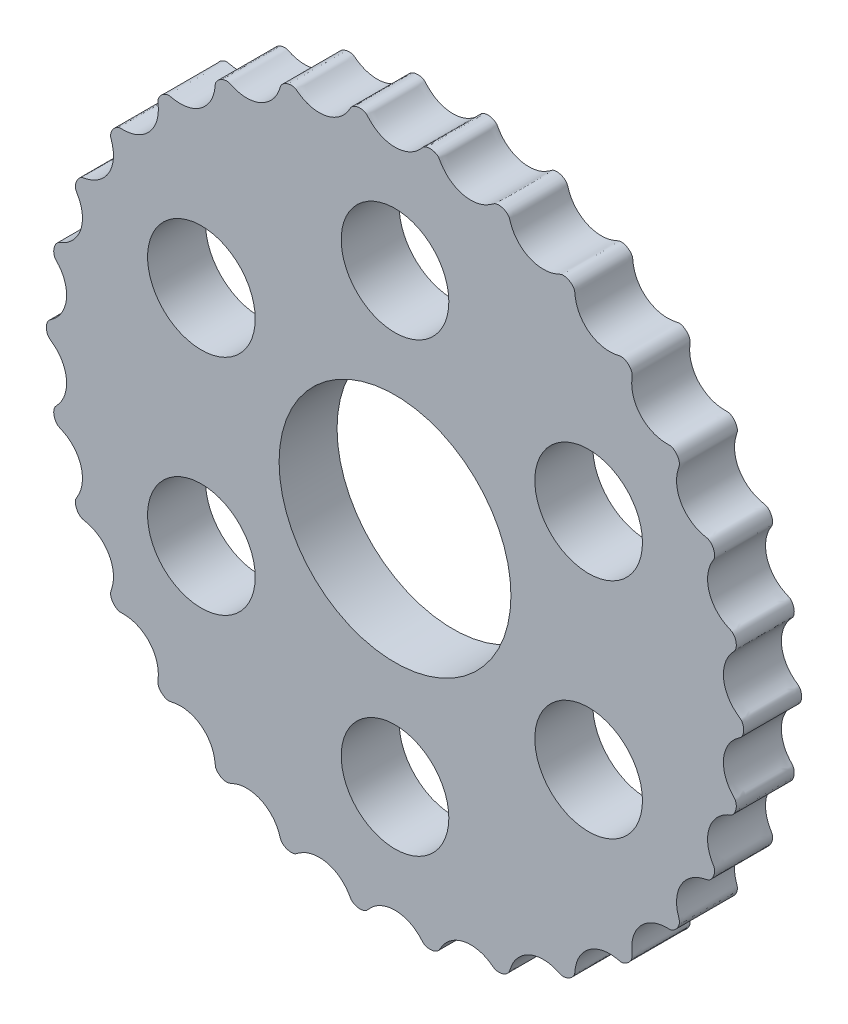
from build123d import *

# Parameters (mm, degrees)
BOSS_EXTRUDE2_DEPTH = 7
SKETCH5_R           = 14
SKETCH5_R_2         = 6.5
CUT_EXTRUDE2_DEPTH  = 7


with BuildPart() as part:
    # Sketch4 → Boss-Extrude2 (new body)
    with BuildSketch(Plane.XY):
        with BuildLine():
            add(Edge.make_bspline(
                [(0, 39.9), (-0.867862173, 39.9), (-2.053769009, 40.297142286), (-2.993701321, 41.15010635), (-3.290716037, 41.483410093), (-3.394824363, 41.596730239), (-3.451153808, 41.648851793), (-3.508551514, 41.691620086), (-3.587956385, 41.738653868), (-3.698246562, 41.788603484), (-3.840725679, 41.834402719), (-4.01118888, 41.867939782), (-4.201523411, 41.882323153), (-4.40107338, 41.873405416), (-4.598116651, 41.840636229), (-4.781304367, 41.78700752), (-4.94106606, 41.718752256), (-5.070904682, 41.644330318), (-5.168403341, 41.572548193), (-5.23629071, 41.510028931), (-5.283550467, 41.456265489), (-5.327802047, 41.393558839), (-5.406082214, 41.261074736), (-5.627304443, 40.873297035), (-6.3693724, 39.843566652), (-8.235255534, 38.74379281), (-10.387118038, 38.989581665), (-11.483883972, 39.628428942), (-11.843675344, 39.892743014), (-11.969095474, 39.981903479), (-12.035021107, 40.021196066), (-12.100060784, 40.051087697), (-12.187504024, 40.080603604), (-12.305776156, 40.106502749), (-12.454658081, 40.121702633), (-12.628368763, 40.119052453), (-12.817530355, 40.093536021), (-13.010873806, 40.043345394), (-13.1967931, 39.970312141), (-13.364824622, 39.879771162), (-13.50691375, 39.77980239), (-13.618420685, 39.679988309), (-13.698891055, 39.589522313), (-13.752279067, 39.514244292), (-13.787345076, 39.451839), (-13.817568032, 39.381291859), (-13.866629173, 39.235440902), (-14.002343934, 38.810124757), (-14.514147108, 37.648628945), (-16.110568287, 36.184932781), (-18.266525561, 35.977959715), (-19.472144723, 36.374823111), (-19.879029007, 36.558552949), (-20.020246261, 36.619689471), (-20.092902659, 36.644418038), (-20.162739421, 36.660123399), (-20.254406118, 36.670823157), (-20.375476281, 36.671556594), (-20.524265484, 36.655482765), (-20.693633391, 36.616776963), (-20.873353144, 36.552480209), (-21.052032881, 36.46318634), (-21.218708339, 36.353102), (-21.364236105, 36.229590507), (-21.482450087, 36.10227854), (-21.570763539, 35.981456079), (-21.630649294, 35.876231819), (-21.66723675, 35.791504827), (-21.688550736, 35.72317075), (-21.703453992, 35.647884895), (-21.721120537, 35.495020633), (-21.765446262, 35.050781121), (-22.024570861, 33.808253812), (-23.281787595, 32.044648934), (-25.347602516, 31.393897517), (-26.609377531, 31.531487852), (-27.045578774, 31.626549793), (-27.196412701, 31.657030459), (-27.272625968, 31.666092766), (-27.344202322, 31.66695979), (-27.436086449, 31.658334151), (-27.554668468, 31.63391253), (-27.696858442, 31.587225288), (-27.854479363, 31.51415622), (-28.016910616, 31.413909426), (-28.17312248, 31.289420344), (-28.313249318, 31.147072883), (-28.429939632, 30.996019107), (-28.51907839, 30.846898913), (-28.580371612, 30.710365831), (-28.617050925, 30.594986054), (-28.635236785, 30.504503244), (-28.641856958, 30.433231277), (-28.640811645, 30.356489439), (-28.626260334, 30.203298111), (-28.577310262, 29.759547319), (-28.572378806, 28.490299736), (-29.435493607, 26.503830076), (-31.320855821, 25.437825908), (-32.583663593, 25.310034872), (-33.030099211, 25.312357592), (-33.1839743, 25.310795606), (-33.260405999, 25.303822489), (-33.330596599, 25.289777884), (-33.418681028, 25.262241256), (-33.529592958, 25.213696494), (-33.658965182, 25.138464354), (-33.797955686, 25.0342296), (-33.935992938, 24.902397018), (-34.062909452, 24.748150521), (-34.17038123, 24.579777083), (-34.253117673, 24.407763884), (-34.30930012, 24.243364778), (-34.34086238, 24.097075442), (-34.352766326, 23.976589981), (-34.351724814, 23.884307609), (-34.343403373, 23.813210072), (-34.326391089, 23.738372389), (-34.280353354, 23.591541797), (-34.140155476, 23.167682585), (-33.871504163, 21.927178673), (-34.302697492, 19.804685831), (-35.925234266, 18.369949976), (-37.133886991, 17.982442368), (-37.571043574, 17.891866094), (-37.721235663, 17.858357953), (-37.794548417, 17.83564683), (-37.860277764, 17.807304514), (-37.940725669, 17.762080132), (-38.039105993, 17.691509807), (-38.150029804, 17.591046281), (-38.26429222, 17.460175106), (-38.37190826, 17.302530324), (-38.463966784, 17.125260998), (-38.534115325, 16.938233404), (-38.579257238, 16.752772137), (-38.600045748, 16.580286821), (-38.600492513, 16.430633118), (-38.587083879, 16.310305933), (-38.566890979, 16.220251558), (-38.543954221, 16.152442484), (-38.511778493, 16.082764651), (-38.436178924, 15.948733596), (-38.21096583, 15.563261882), (-37.690235222, 14.405744429), (-37.670740143, 12.23996324), (-38.959525869, 10.499276186), (-40.061170431, 9.868887576), (-40.469960363, 9.68944059), (-40.609889204, 9.62541929), (-40.676885583, 9.587972137), (-40.735287905, 9.546578387), (-40.804571348, 9.485611057), (-40.88613014, 9.396134355), (-40.973735666, 9.274802793), (-41.058313935, 9.123046913), (-41.130780329, 8.946459582), (-41.183982978, 8.753927812), (-41.213699302, 8.556399698), (-41.219300672, 8.365606209), (-41.203785057, 8.192565592), (-41.173088823, 8.046093135), (-41.134972279, 7.931178846), (-41.096477862, 7.847299492), (-41.05995772, 7.78573425), (-41.01399797, 7.724267701), (-40.912186828, 7.608880775), (-40.611759089, 7.278650812), (-39.861724818, 6.254715406), (-39.392356495, 4.140291659), (-40.291109103, 2.169726977), (-41.237583496, 1.324026514), (-41.600150739, 1.063532091), (-41.723700707, 0.971799219), (-41.781453664, 0.921250534), (-41.829976569, 0.868623412), (-41.88505136, 0.794571708), (-41.94624731, 0.690106561), (-42.00669721, 0.553203928), (-42.057873473, 0.38717871), (-42.092051529, 0.19938699), (-42.104064912, 0), (-42.092051529, -0.19938699), (-42.057873473, -0.38717871), (-42.00669721, -0.553203928), (-41.94624731, -0.690106561), (-41.88505136, -0.794571708), (-41.829976569, -0.868623412), (-41.781453664, -0.921250534), (-41.723700707, -0.971799219), (-41.600150739, -1.063532091), (-41.237583496, -1.324026514), (-40.291109103, -2.169726977), (-39.392356495, -4.140291659), (-39.861724818, -6.254715406), (-40.611759089, -7.278650812), (-40.912186828, -7.608880775), (-41.01399797, -7.724267701), (-41.05995772, -7.78573425), (-41.096477862, -7.847299492), (-41.134972279, -7.931178846), (-41.173088823, -8.046093135), (-41.203785057, -8.192565592), (-41.219300672, -8.365606209), (-41.213699302, -8.556399698), (-41.183982978, -8.753927812), (-41.130780329, -8.946459582), (-41.058313935, -9.123046913), (-40.973735666, -9.274802793), (-40.88613014, -9.396134355), (-40.804571348, -9.485611057), (-40.735287905, -9.546578387), (-40.676885583, -9.587972137), (-40.609889204, -9.62541929), (-40.469960363, -9.68944059), (-40.061170431, -9.868887576), (-38.959525869, -10.499276186), (-37.670740143, -12.23996324), (-37.690235222, -14.405744429), (-38.21096583, -15.563261882), (-38.436178924, -15.948733596), (-38.511778493, -16.082764651), (-38.543954221, -16.152442484), (-38.566890979, -16.220251558), (-38.587083879, -16.310305933), (-38.600492513, -16.430633118), (-38.600045748, -16.580286821), (-38.579257238, -16.752772137), (-38.534115325, -16.938233404), (-38.463966784, -17.125260998), (-38.37190826, -17.302530324), (-38.26429222, -17.460175106), (-38.150029804, -17.591046281), (-38.039105993, -17.691509807), (-37.940725669, -17.762080132), (-37.860277764, -17.807304514), (-37.794548417, -17.83564683), (-37.721235663, -17.858357953), (-37.571043574, -17.891866094), (-37.133886991, -17.982442368), (-35.925234266, -18.369949976), (-34.302697492, -19.804685831), (-33.871504163, -21.927178673), (-34.140155476, -23.167682585), (-34.280353354, -23.591541797), (-34.326391089, -23.738372389), (-34.343403373, -23.813210072), (-34.351724814, -23.884307609), (-34.352766326, -23.976589981), (-34.34086238, -24.097075442), (-34.30930012, -24.243364778), (-34.253117673, -24.407763884), (-34.17038123, -24.579777083), (-34.062909452, -24.748150521), (-33.935992938, -24.902397018), (-33.797955686, -25.0342296), (-33.658965182, -25.138464354), (-33.529592958, -25.213696494), (-33.418681028, -25.262241256), (-33.330596599, -25.289777884), (-33.260405999, -25.303822489), (-33.1839743, -25.310795606), (-33.030099211, -25.312357592), (-32.583663593, -25.310034872), (-31.320855821, -25.437825908), (-29.435493607, -26.503830076), (-28.572378806, -28.490299736), (-28.577310262, -29.759547319), (-28.626260334, -30.203298111), (-28.640811645, -30.356489439), (-28.641856958, -30.433231277), (-28.635236785, -30.504503244), (-28.617050925, -30.594986054), (-28.580371612, -30.710365831), (-28.51907839, -30.846898913), (-28.429939632, -30.996019107), (-28.313249318, -31.147072883), (-28.17312248, -31.289420344), (-28.016910616, -31.413909426), (-27.854479363, -31.51415622), (-27.696858442, -31.587225288), (-27.554668468, -31.63391253), (-27.436086449, -31.658334151), (-27.344202322, -31.66695979), (-27.272625968, -31.666092766), (-27.196412701, -31.657030459), (-27.045578774, -31.626549793), (-26.609377531, -31.531487852), (-25.347602516, -31.393897517), (-23.281787595, -32.044648934), (-22.024570861, -33.808253812), (-21.765446262, -35.050781121), (-21.721120537, -35.495020633), (-21.703453992, -35.647884895), (-21.688550736, -35.72317075), (-21.66723675, -35.791504827), (-21.630649294, -35.876231819), (-21.570763539, -35.981456079), (-21.482450087, -36.10227854), (-21.364236105, -36.229590507), (-21.218708339, -36.353102), (-21.052032881, -36.46318634), (-20.873353144, -36.552480209), (-20.693633391, -36.616776963), (-20.524265484, -36.655482765), (-20.375476281, -36.671556594), (-20.254406118, -36.670823157), (-20.162739421, -36.660123399), (-20.092902659, -36.644418038), (-20.020246261, -36.619689471), (-19.879029007, -36.558552949), (-19.472144723, -36.374823111), (-18.266525561, -35.977959715), (-16.110568287, -36.184932781), (-14.514147108, -37.648628945), (-14.002343934, -38.810124757), (-13.866629173, -39.235440902), (-13.817568032, -39.381291859), (-13.787345076, -39.451839), (-13.752279067, -39.514244292), (-13.698891055, -39.589522313), (-13.618420685, -39.679988309), (-13.50691375, -39.77980239), (-13.364824622, -39.879771162), (-13.1967931, -39.970312141), (-13.010873806, -40.043345394), (-12.817530355, -40.093536021), (-12.628368763, -40.119052453), (-12.454658081, -40.121702633), (-12.305776156, -40.106502749), (-12.187504024, -40.080603604), (-12.100060784, -40.051087697), (-12.035021107, -40.021196066), (-11.969095474, -39.981903479), (-11.843675344, -39.892743014), (-11.483883972, -39.628428942), (-10.387118038, -38.989581665), (-8.235255534, -38.74379281), (-6.3693724, -39.843566652), (-5.627304443, -40.873297035), (-5.406082214, -41.261074736), (-5.327802047, -41.393558839), (-5.283550467, -41.456265489), (-5.23629071, -41.510028931), (-5.168403341, -41.572548193), (-5.070904682, -41.644330318), (-4.94106606, -41.718752256), (-4.781304367, -41.78700752), (-4.598116651, -41.840636229), (-4.40107338, -41.873405416), (-4.201523411, -41.882323153), (-4.01118888, -41.867939782), (-3.840725679, -41.834402719), (-3.698246562, -41.788603484), (-3.587956385, -41.738653868), (-3.508551514, -41.691620086), (-3.451153808, -41.648851793), (-3.394824363, -41.596730239), (-3.290716037, -41.483410093), (-2.993701321, -41.15010635), (-2.053769009, -40.297142286), (0, -39.609366068), (2.053769009, -40.297142286), (2.993701321, -41.15010635), (3.290716037, -41.483410093), (3.394824363, -41.596730239), (3.451153808, -41.648851793), (3.508551514, -41.691620086), (3.587956385, -41.738653868), (3.698246562, -41.788603484), (3.840725679, -41.834402719), (4.01118888, -41.867939782), (4.201523411, -41.882323153), (4.40107338, -41.873405416), (4.598116651, -41.840636229), (4.781304367, -41.78700752), (4.94106606, -41.718752256), (5.070904682, -41.644330318), (5.168403341, -41.572548193), (5.23629071, -41.510028931), (5.283550467, -41.456265489), (5.327802047, -41.393558839), (5.406082214, -41.261074736), (5.627304443, -40.873297035), (6.3693724, -39.843566652), (8.235255534, -38.74379281), (10.387118038, -38.989581665), (11.483883972, -39.628428942), (11.843675344, -39.892743014), (11.969095474, -39.981903479), (12.035021107, -40.021196066), (12.100060784, -40.051087697), (12.187504024, -40.080603604), (12.305776156, -40.106502749), (12.454658081, -40.121702633), (12.628368763, -40.119052453), (12.817530355, -40.093536021), (13.010873806, -40.043345394), (13.1967931, -39.970312141), (13.364824622, -39.879771162), (13.50691375, -39.77980239), (13.618420685, -39.679988309), (13.698891055, -39.589522313), (13.752279067, -39.514244292), (13.787345076, -39.451839), (13.817568032, -39.381291859), (13.866629173, -39.235440902), (14.002343934, -38.810124757), (14.514147108, -37.648628945), (16.110568287, -36.184932781), (18.266525561, -35.977959715), (19.472144723, -36.374823111), (19.879029007, -36.558552949), (20.020246261, -36.619689471), (20.092902659, -36.644418038), (20.162739421, -36.660123399), (20.254406118, -36.670823157), (20.375476281, -36.671556594), (20.524265484, -36.655482765), (20.693633391, -36.616776963), (20.873353144, -36.552480209), (21.052032881, -36.46318634), (21.218708339, -36.353102), (21.364236105, -36.229590507), (21.482450087, -36.10227854), (21.570763539, -35.981456079), (21.630649294, -35.876231819), (21.66723675, -35.791504827), (21.688550736, -35.72317075), (21.703453992, -35.647884895), (21.721120537, -35.495020633), (21.765446262, -35.050781121), (22.024570861, -33.808253812), (23.281787595, -32.044648934), (25.347602516, -31.393897517), (26.609377531, -31.531487852), (27.045578774, -31.626549793), (27.196412701, -31.657030459), (27.272625968, -31.666092766), (27.344202322, -31.66695979), (27.436086449, -31.658334151), (27.554668468, -31.63391253), (27.696858442, -31.587225288), (27.854479363, -31.51415622), (28.016910616, -31.413909426), (28.17312248, -31.289420344), (28.313249318, -31.147072883), (28.429939632, -30.996019107), (28.51907839, -30.846898913), (28.580371612, -30.710365831), (28.617050925, -30.594986054), (28.635236785, -30.504503244), (28.641856958, -30.433231277), (28.640811645, -30.356489439), (28.626260334, -30.203298111), (28.577310262, -29.759547319), (28.572378806, -28.490299736), (29.435493607, -26.503830076), (31.320855821, -25.437825908), (32.583663593, -25.310034872), (33.030099211, -25.312357592), (33.1839743, -25.310795606), (33.260405999, -25.303822489), (33.330596599, -25.289777884), (33.418681028, -25.262241256), (33.529592958, -25.213696494), (33.658965182, -25.138464354), (33.797955686, -25.0342296), (33.935992938, -24.902397018), (34.062909452, -24.748150521), (34.17038123, -24.579777083), (34.253117673, -24.407763884), (34.30930012, -24.243364778), (34.34086238, -24.097075442), (34.352766326, -23.976589981), (34.351724814, -23.884307609), (34.343403373, -23.813210072), (34.326391089, -23.738372389), (34.280353354, -23.591541797), (34.140155476, -23.167682585), (33.871504163, -21.927178673), (34.302697492, -19.804685831), (35.925234266, -18.369949976), (37.133886991, -17.982442368), (37.571043574, -17.891866094), (37.721235663, -17.858357953), (37.794548417, -17.83564683), (37.860277764, -17.807304514), (37.940725669, -17.762080132), (38.039105993, -17.691509807), (38.150029804, -17.591046281), (38.26429222, -17.460175106), (38.37190826, -17.302530324), (38.463966784, -17.125260998), (38.534115325, -16.938233404), (38.579257238, -16.752772137), (38.600045748, -16.580286821), (38.600492513, -16.430633118), (38.587083879, -16.310305933), (38.566890979, -16.220251558), (38.543954221, -16.152442484), (38.511778493, -16.082764651), (38.436178924, -15.948733596), (38.21096583, -15.563261882), (37.690235222, -14.405744429), (37.670740143, -12.23996324), (38.959525869, -10.499276186), (40.061170431, -9.868887576), (40.469960363, -9.68944059), (40.609889204, -9.62541929), (40.676885583, -9.587972137), (40.735287905, -9.546578387), (40.804571348, -9.485611057), (40.88613014, -9.396134355), (40.973735666, -9.274802793), (41.058313935, -9.123046913), (41.130780329, -8.946459582), (41.183982978, -8.753927812), (41.213699302, -8.556399698), (41.219300672, -8.365606209), (41.203785057, -8.192565592), (41.173088823, -8.046093135), (41.134972279, -7.931178846), (41.096477862, -7.847299492), (41.05995772, -7.78573425), (41.01399797, -7.724267701), (40.912186828, -7.608880775), (40.611759089, -7.278650812), (39.861724818, -6.254715406), (39.392356495, -4.140291659), (40.291109103, -2.169726977), (41.237583496, -1.324026514), (41.600150739, -1.063532091), (41.723700707, -0.971799219), (41.781453664, -0.921250534), (41.829976569, -0.868623412), (41.88505136, -0.794571708), (41.94624731, -0.690106561), (42.00669721, -0.553203928), (42.057873473, -0.38717871), (42.092051529, -0.19938699), (42.104064912, 0), (42.092051529, 0.19938699), (42.057873473, 0.38717871), (42.00669721, 0.553203928), (41.94624731, 0.690106561), (41.88505136, 0.794571708), (41.829976569, 0.868623412), (41.781453664, 0.921250534), (41.723700707, 0.971799219), (41.600150739, 1.063532091), (41.237583496, 1.324026514), (40.291109103, 2.169726977), (39.392356495, 4.140291659), (39.861724818, 6.254715406), (40.611759089, 7.278650812), (40.912186828, 7.608880775), (41.01399797, 7.724267701), (41.05995772, 7.78573425), (41.096477862, 7.847299492), (41.134972279, 7.931178846), (41.173088823, 8.046093135), (41.203785057, 8.192565592), (41.219300672, 8.365606209), (41.213699302, 8.556399698), (41.183982978, 8.753927812), (41.130780329, 8.946459582), (41.058313935, 9.123046913), (40.973735666, 9.274802793), (40.88613014, 9.396134355), (40.804571348, 9.485611057), (40.735287905, 9.546578387), (40.676885583, 9.587972137), (40.609889204, 9.62541929), (40.469960363, 9.68944059), (40.061170431, 9.868887576), (38.959525869, 10.499276186), (37.670740143, 12.23996324), (37.690235222, 14.405744429), (38.21096583, 15.563261882), (38.436178924, 15.948733596), (38.511778493, 16.082764651), (38.543954221, 16.152442484), (38.566890979, 16.220251558), (38.587083879, 16.310305933), (38.600492513, 16.430633118), (38.600045748, 16.580286821), (38.579257238, 16.752772137), (38.534115325, 16.938233404), (38.463966784, 17.125260998), (38.37190826, 17.302530324), (38.26429222, 17.460175106), (38.150029804, 17.591046281), (38.039105993, 17.691509807), (37.940725669, 17.762080132), (37.860277764, 17.807304514), (37.794548417, 17.83564683), (37.721235663, 17.858357953), (37.571043574, 17.891866094), (37.133886991, 17.982442368), (35.925234266, 18.369949976), (34.302697492, 19.804685831), (33.871504163, 21.927178673), (34.140155476, 23.167682585), (34.280353354, 23.591541797), (34.326391089, 23.738372389), (34.343403373, 23.813210072), (34.351724814, 23.884307609), (34.352766326, 23.976589981), (34.34086238, 24.097075442), (34.30930012, 24.243364778), (34.253117673, 24.407763884), (34.17038123, 24.579777083), (34.062909452, 24.748150521), (33.935992938, 24.902397018), (33.797955686, 25.0342296), (33.658965182, 25.138464354), (33.529592958, 25.213696494), (33.418681028, 25.262241256), (33.330596599, 25.289777884), (33.260405999, 25.303822489), (33.1839743, 25.310795606), (33.030099211, 25.312357592), (32.583663593, 25.310034872), (31.320855821, 25.437825908), (29.435493607, 26.503830076), (28.572378806, 28.490299736), (28.577310262, 29.759547319), (28.626260334, 30.203298111), (28.640811645, 30.356489439), (28.641856958, 30.433231277), (28.635236785, 30.504503244), (28.617050925, 30.594986054), (28.580371612, 30.710365831), (28.51907839, 30.846898913), (28.429939632, 30.996019107), (28.313249318, 31.147072883), (28.17312248, 31.289420344), (28.016910616, 31.413909426), (27.854479363, 31.51415622), (27.696858442, 31.587225288), (27.554668468, 31.63391253), (27.436086449, 31.658334151), (27.344202322, 31.66695979), (27.272625968, 31.666092766), (27.196412701, 31.657030459), (27.045578774, 31.626549793), (26.609377531, 31.531487852), (25.347602516, 31.393897517), (23.281787595, 32.044648934), (22.024570861, 33.808253812), (21.765446262, 35.050781121), (21.721120537, 35.495020633), (21.703453992, 35.647884895), (21.688550736, 35.72317075), (21.66723675, 35.791504827), (21.630649294, 35.876231819), (21.570763539, 35.981456079), (21.482450087, 36.10227854), (21.364236105, 36.229590507), (21.218708339, 36.353102), (21.052032881, 36.46318634), (20.873353144, 36.552480209), (20.693633391, 36.616776963), (20.524265484, 36.655482765), (20.375476281, 36.671556594), (20.254406118, 36.670823157), (20.162739421, 36.660123399), (20.092902659, 36.644418038), (20.020246261, 36.619689471), (19.879029007, 36.558552949), (19.472144723, 36.374823111), (18.266525561, 35.977959715), (16.110568287, 36.184932781), (14.514147108, 37.648628945), (14.002343934, 38.810124757), (13.866629173, 39.235440902), (13.817568032, 39.381291859), (13.787345076, 39.451839), (13.752279067, 39.514244292), (13.698891055, 39.589522313), (13.618420685, 39.679988309), (13.50691375, 39.77980239), (13.364824622, 39.879771162), (13.1967931, 39.970312141), (13.010873806, 40.043345394), (12.817530355, 40.093536021), (12.628368763, 40.119052453), (12.454658081, 40.121702633), (12.305776156, 40.106502749), (12.187504024, 40.080603604), (12.100060784, 40.051087697), (12.035021107, 40.021196066), (11.969095474, 39.981903479), (11.843675344, 39.892743014), (11.483883972, 39.628428942), (10.387118038, 38.989581665), (8.235255534, 38.74379281), (6.3693724, 39.843566652), (5.627304443, 40.873297035), (5.406082214, 41.261074736), (5.327802047, 41.393558839), (5.283550467, 41.456265489), (5.23629071, 41.510028931), (5.168403341, 41.572548193), (5.070904682, 41.644330318), (4.94106606, 41.718752256), (4.781304367, 41.78700752), (4.598116651, 41.840636229), (4.40107338, 41.873405416), (4.201523411, 41.882323153), (4.01118888, 41.867939782), (3.840725679, 41.834402719), (3.698246562, 41.788603484), (3.587956385, 41.738653868), (3.508551514, 41.691620086), (3.451153808, 41.648851793), (3.394824363, 41.596730239), (3.290716037, 41.483410093), (2.993701321, 41.15010635), (2.053769009, 40.297142286), (0.867862173, 39.9), (0, 39.9)],
                knots=[0, 0, 0, 0, 0.008602786, 0.011755441, 0.012752437, 0.013108393, 0.013307618, 0.013525908, 0.013829396, 0.014237176, 0.014745109, 0.015336248, 0.015986256, 0.016666676, 0.017347087, 0.017997108, 0.018588232, 0.019096165, 0.019503928, 0.019807419, 0.02002573, 0.020224954, 0.02058093, 0.021577911, 0.024730567, 0.033333347, 0.041936115, 0.045088772, 0.046085758, 0.046441723, 0.046640961, 0.046859256, 0.047162726, 0.047570531, 0.048078457, 0.04866956, 0.04931959, 0.050000017, 0.050680424, 0.05133043, 0.05192155, 0.052429496, 0.052837265, 0.053140768, 0.05335905, 0.053558291, 0.053914275, 0.05491124, 0.058063892, 0.066666682, 0.075269475, 0.078422116, 0.079419099, 0.079775077, 0.079974313, 0.080192617, 0.080496093, 0.080903873, 0.081411792, 0.082002926, 0.082652957, 0.083333352, 0.084013775, 0.084663775, 0.085254921, 0.085762846, 0.086170617, 0.086474106, 0.086692409, 0.086891627, 0.0872476, 0.088244596, 0.091397248, 0.100000008, 0.108602792, 0.111755467, 0.112752416, 0.113108388, 0.113307644, 0.113525948, 0.113829411, 0.114237188, 0.114745121, 0.115336258, 0.115986289, 0.116666679, 0.117347089, 0.117997096, 0.118588252, 0.119096158, 0.11950396, 0.119807415, 0.120025746, 0.120224954, 0.120580936, 0.121577901, 0.124730579, 0.133333357, 0.141936132, 0.145088775, 0.146085761, 0.146441737, 0.14664096, 0.146859281, 0.147162761, 0.147570512, 0.148078445, 0.148669592, 0.149319606, 0.150000021, 0.150680429, 0.151330451, 0.151921592, 0.152429521, 0.15283728, 0.153140767, 0.153359078, 0.153558308, 0.153914262, 0.154911239, 0.15806391, 0.166666686, 0.175269482, 0.178422128, 0.179419095, 0.179775086, 0.179974331, 0.180192617, 0.180496092, 0.180903881, 0.181411807, 0.182002934, 0.182652958, 0.183333362, 0.184013762, 0.184663808, 0.185254923, 0.185762856, 0.186170617, 0.18647411, 0.186692426, 0.186891655, 0.18724762, 0.188244596, 0.191397256, 0.20000002, 0.208602787, 0.211755471, 0.212752409, 0.213108381, 0.213307629, 0.213525949, 0.213829427, 0.214237188, 0.214745098, 0.215336243, 0.215986265, 0.216666684, 0.217347074, 0.217997115, 0.218588256, 0.219096165, 0.219503935, 0.219807423, 0.22002574, 0.220224965, 0.220580939, 0.221577915, 0.224730555, 0.233333324, 0.241936119, 0.245088778, 0.246085745, 0.246441723, 0.246640965, 0.246859273, 0.247162747, 0.24757051, 0.24807843, 0.248669562, 0.249319603, 0.25, 0.250680397, 0.251330438, 0.25192157, 0.25242949, 0.252837253, 0.253140727, 0.253359035, 0.253558277, 0.253914255, 0.254911222, 0.258063881, 0.266666676, 0.275269445, 0.278422085, 0.279419061, 0.279775035, 0.27997426, 0.280192577, 0.280496065, 0.280903835, 0.281411744, 0.282002885, 0.282652926, 0.283333316, 0.284013735, 0.284663757, 0.285254902, 0.285762812, 0.286170573, 0.286474051, 0.286692371, 0.286891619, 0.287247591, 0.288244529, 0.291397213, 0.29999998, 0.308602744, 0.311755404, 0.31275238, 0.313108345, 0.313307574, 0.31352589, 0.313829383, 0.314237144, 0.314745077, 0.315336192, 0.315986238, 0.316666638, 0.317347042, 0.317997066, 0.318588193, 0.319096119, 0.319503908, 0.319807383, 0.320025669, 0.320224914, 0.320580905, 0.321577872, 0.324730518, 0.333333314, 0.34193609, 0.345088761, 0.346085738, 0.346441692, 0.346640922, 0.346859233, 0.34716272, 0.347570479, 0.348078408, 0.348669549, 0.349319571, 0.349999979, 0.350680394, 0.351330408, 0.351921555, 0.352429488, 0.352837239, 0.353140719, 0.35335904, 0.353558263, 0.353914239, 0.354911225, 0.358063868, 0.366666643, 0.375269421, 0.378422099, 0.379419064, 0.379775046, 0.379974254, 0.380192585, 0.38049604, 0.380903842, 0.381411748, 0.382002904, 0.382652911, 0.383333321, 0.384013711, 0.384663742, 0.385254879, 0.385762812, 0.386170589, 0.386474052, 0.386692356, 0.386891612, 0.387247584, 0.388244533, 0.391397208, 0.399999992, 0.408602752, 0.411755404, 0.4127524, 0.413108373, 0.413307591, 0.413525894, 0.413829383, 0.414237154, 0.414745079, 0.415336225, 0.415986225, 0.416666648, 0.417347043, 0.417997074, 0.418588208, 0.419096127, 0.419503907, 0.419807383, 0.420025687, 0.420224923, 0.420580901, 0.421577884, 0.424730525, 0.433333318, 0.441936108, 0.44508876, 0.446085725, 0.446441709, 0.44664095, 0.446859232, 0.447162735, 0.447570504, 0.44807845, 0.44866957, 0.449319576, 0.449999983, 0.45068041, 0.45133044, 0.451921543, 0.452429469, 0.452837274, 0.453140744, 0.453359039, 0.453558277, 0.453914242, 0.454911228, 0.458063885, 0.466666653, 0.475269433, 0.478422089, 0.47941907, 0.479775046, 0.47997427, 0.480192581, 0.480496072, 0.480903835, 0.481411768, 0.482002892, 0.482652913, 0.483333324, 0.484013744, 0.484663752, 0.485254891, 0.485762824, 0.486170604, 0.486474092, 0.486692382, 0.486891607, 0.487247563, 0.488244559, 0.491397214, 0.5, 0.508602786, 0.511755441, 0.512752437, 0.513108393, 0.513307618, 0.513525908, 0.513829396, 0.514237176, 0.514745109, 0.515336248, 0.515986256, 0.516666676, 0.517347087, 0.517997108, 0.518588232, 0.519096165, 0.519503928, 0.519807419, 0.52002573, 0.520224954, 0.52058093, 0.521577911, 0.524730567, 0.533333347, 0.541936115, 0.545088772, 0.546085758, 0.546441723, 0.546640961, 0.546859256, 0.547162726, 0.547570531, 0.548078457, 0.54866956, 0.54931959, 0.550000017, 0.550680424, 0.55133043, 0.55192155, 0.552429496, 0.552837265, 0.553140768, 0.55335905, 0.553558291, 0.553914275, 0.55491124, 0.558063892, 0.566666682, 0.575269475, 0.578422116, 0.579419099, 0.579775077, 0.579974313, 0.580192617, 0.580496093, 0.580903873, 0.581411792, 0.582002926, 0.582652957, 0.583333352, 0.584013775, 0.584663775, 0.585254921, 0.585762846, 0.586170617, 0.586474106, 0.586692409, 0.586891627, 0.5872476, 0.588244596, 0.591397248, 0.600000008, 0.608602792, 0.611755467, 0.612752416, 0.613108388, 0.613307644, 0.613525948, 0.613829411, 0.614237188, 0.614745121, 0.615336258, 0.615986289, 0.616666679, 0.617347089, 0.617997096, 0.618588252, 0.619096158, 0.61950396, 0.619807415, 0.620025746, 0.620224954, 0.620580936, 0.621577901, 0.624730579, 0.633333357, 0.641936132, 0.645088775, 0.646085761, 0.646441737, 0.64664096, 0.646859281, 0.647162761, 0.647570512, 0.648078445, 0.648669592, 0.649319606, 0.650000021, 0.650680429, 0.651330451, 0.651921592, 0.652429521, 0.65283728, 0.653140767, 0.653359078, 0.653558308, 0.653914262, 0.654911239, 0.65806391, 0.666666686, 0.675269482, 0.678422128, 0.679419095, 0.679775086, 0.679974331, 0.680192617, 0.680496092, 0.680903881, 0.681411807, 0.682002934, 0.682652958, 0.683333362, 0.684013762, 0.684663808, 0.685254923, 0.685762856, 0.686170617, 0.68647411, 0.686692426, 0.686891655, 0.68724762, 0.688244596, 0.691397256, 0.70000002, 0.708602787, 0.711755471, 0.712752409, 0.713108381, 0.713307629, 0.713525949, 0.713829427, 0.714237188, 0.714745098, 0.715336243, 0.715986265, 0.716666684, 0.717347074, 0.717997115, 0.718588256, 0.719096165, 0.719503935, 0.719807423, 0.72002574, 0.720224965, 0.720580939, 0.721577915, 0.724730555, 0.733333324, 0.741936119, 0.745088778, 0.746085745, 0.746441723, 0.746640965, 0.746859273, 0.747162747, 0.74757051, 0.74807843, 0.748669562, 0.749319603, 0.75, 0.750680397, 0.751330438, 0.75192157, 0.75242949, 0.752837253, 0.753140727, 0.753359035, 0.753558277, 0.753914255, 0.754911222, 0.758063881, 0.766666676, 0.775269445, 0.778422085, 0.779419061, 0.779775035, 0.77997426, 0.780192577, 0.780496065, 0.780903835, 0.781411744, 0.782002885, 0.782652926, 0.783333316, 0.784013735, 0.784663757, 0.785254902, 0.785762812, 0.786170573, 0.786474051, 0.786692371, 0.786891619, 0.787247591, 0.788244529, 0.791397213, 0.79999998, 0.808602744, 0.811755404, 0.81275238, 0.813108345, 0.813307574, 0.81352589, 0.813829383, 0.814237144, 0.814745077, 0.815336192, 0.815986238, 0.816666638, 0.817347042, 0.817997066, 0.818588193, 0.819096119, 0.819503908, 0.819807383, 0.820025669, 0.820224914, 0.820580905, 0.821577872, 0.824730518, 0.833333314, 0.84193609, 0.845088761, 0.846085738, 0.846441692, 0.846640922, 0.846859233, 0.84716272, 0.847570479, 0.848078408, 0.848669549, 0.849319571, 0.849999979, 0.850680394, 0.851330408, 0.851921555, 0.852429488, 0.852837239, 0.853140719, 0.85335904, 0.853558263, 0.853914239, 0.854911225, 0.858063868, 0.866666643, 0.875269421, 0.878422099, 0.879419064, 0.879775046, 0.879974254, 0.880192585, 0.88049604, 0.880903842, 0.881411748, 0.882002904, 0.882652911, 0.883333321, 0.884013711, 0.884663742, 0.885254879, 0.885762812, 0.886170589, 0.886474052, 0.886692356, 0.886891612, 0.887247584, 0.888244533, 0.891397208, 0.899999992, 0.908602752, 0.911755404, 0.9127524, 0.913108373, 0.913307591, 0.913525894, 0.913829383, 0.914237154, 0.914745079, 0.915336225, 0.915986225, 0.916666648, 0.917347043, 0.917997074, 0.918588208, 0.919096127, 0.919503907, 0.919807383, 0.920025687, 0.920224923, 0.920580901, 0.921577884, 0.924730525, 0.933333318, 0.941936108, 0.94508876, 0.946085725, 0.946441709, 0.94664095, 0.946859232, 0.947162735, 0.947570504, 0.94807845, 0.94866957, 0.949319576, 0.949999983, 0.95068041, 0.95133044, 0.951921543, 0.952429469, 0.952837274, 0.953140744, 0.953359039, 0.953558277, 0.953914242, 0.954911228, 0.958063885, 0.966666653, 0.975269433, 0.978422089, 0.97941907, 0.979775046, 0.97997427, 0.980192581, 0.980496072, 0.980903835, 0.981411768, 0.982002892, 0.982652913, 0.983333324, 0.984013744, 0.984663752, 0.985254891, 0.985762824, 0.986170604, 0.986474092, 0.986692382, 0.986891607, 0.987247563, 0.988244559, 0.991397214, 1, 1, 1, 1], degree=3))
        make_face()
    extrude(amount=BOSS_EXTRUDE2_DEPTH)

    # Sketch5 → Cut-Extrude2 (cut)
    with BuildSketch(Plane.XY.offset(7)):
        Circle(SKETCH5_R)
        with Locations((0, 27)):
            Circle(SKETCH5_R_2)
        with Locations((23.382685902, 13.5)):
            Circle(SKETCH5_R_2)
        with Locations((23.382685902, -13.5)):
            Circle(SKETCH5_R_2)
        with Locations((0, -27)):
            Circle(SKETCH5_R_2)
        with Locations((-23.382685902, -13.5)):
            Circle(SKETCH5_R_2)
        with Locations((-23.382685902, 13.5)):
            Circle(SKETCH5_R_2)
    extrude(amount=-CUT_EXTRUDE2_DEPTH, mode=Mode.SUBTRACT)


solid = part.part
